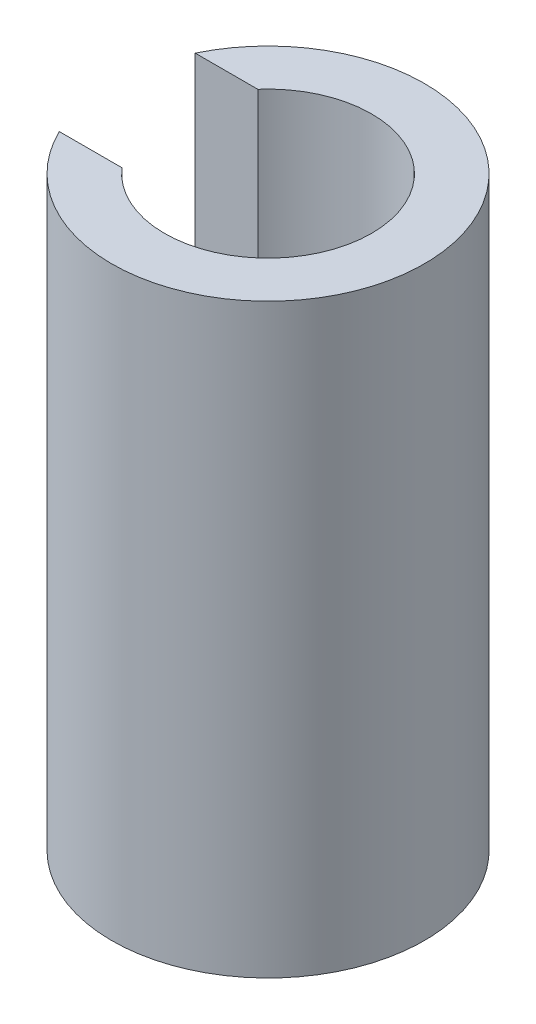
from build123d import *

# Parameters (mm, degrees)
SKETCH_1_R          = 4
SKETCH_1_R_2        = 2.65
EXTRUDE_1_DEPTH     = 15
SKETCH_2_W          = 2
SKETCH_2_H          = 3.47706773
CUT_EXTRUDE_1_DEPTH = 15


with BuildPart() as part:
    # 草圖1 → 填料-伸長1 (new body)
    with BuildSketch(Plane(origin=(0, 0, 0), x_dir=(1, 0, 0), z_dir=(0, 1, 0))):
        Circle(SKETCH_1_R)
        Circle(SKETCH_1_R_2, mode=Mode.SUBTRACT)
    extrude(amount=EXTRUDE_1_DEPTH)

    # 草圖2 → 除料-伸長1 (cut)
    with BuildSketch(Plane(origin=(0, 15, 0), x_dir=(1, 0, 0), z_dir=(0, 1, 0))):
        with Locations((-3, 0)):
            Rectangle(SKETCH_2_W, SKETCH_2_H)
    extrude(amount=-CUT_EXTRUDE_1_DEPTH, mode=Mode.SUBTRACT)


solid = part.part
